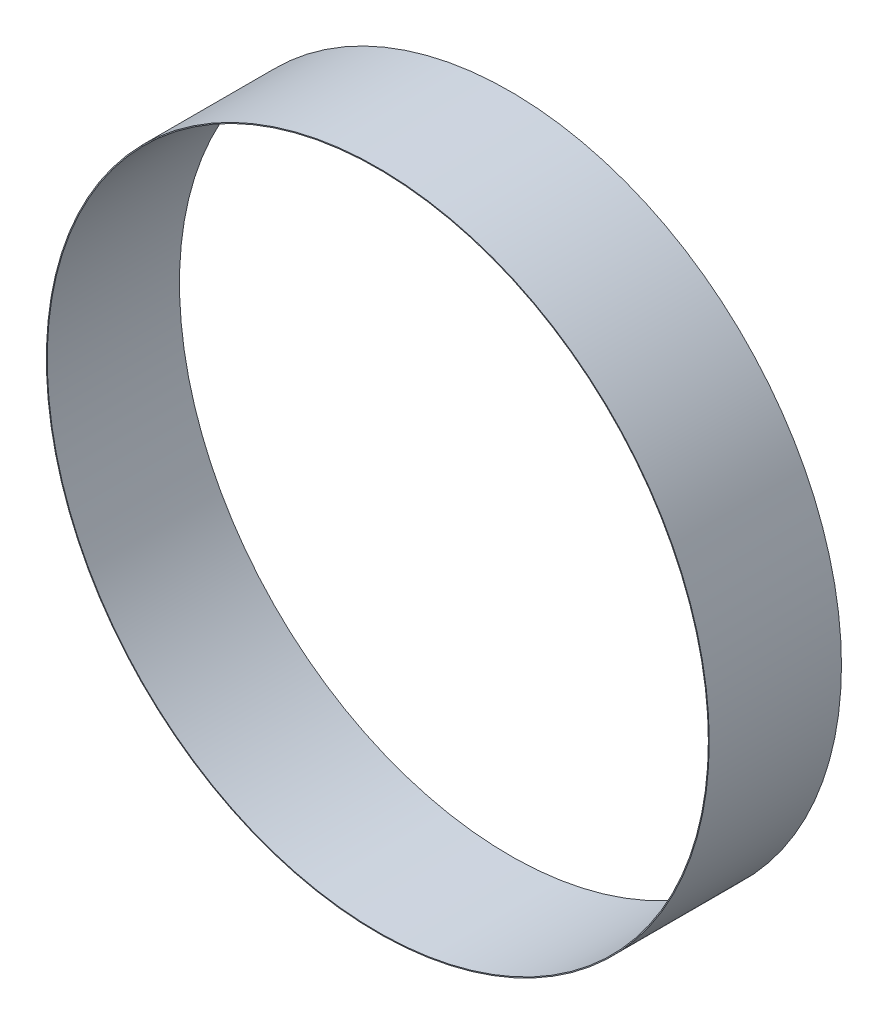
from build123d import *

# Parameters (mm, degrees)
SKETCH1_R           = 75.2
SKETCH1_R_2         = 75
BOSS_EXTRUDE1_DEPTH = 30


with BuildPart() as part:
    # Sketch1 → Boss-Extrude1 (new body)
    with BuildSketch(Plane.XY):
        Circle(SKETCH1_R)
        Circle(SKETCH1_R_2, mode=Mode.SUBTRACT)
    extrude(amount=BOSS_EXTRUDE1_DEPTH)


solid = part.part
